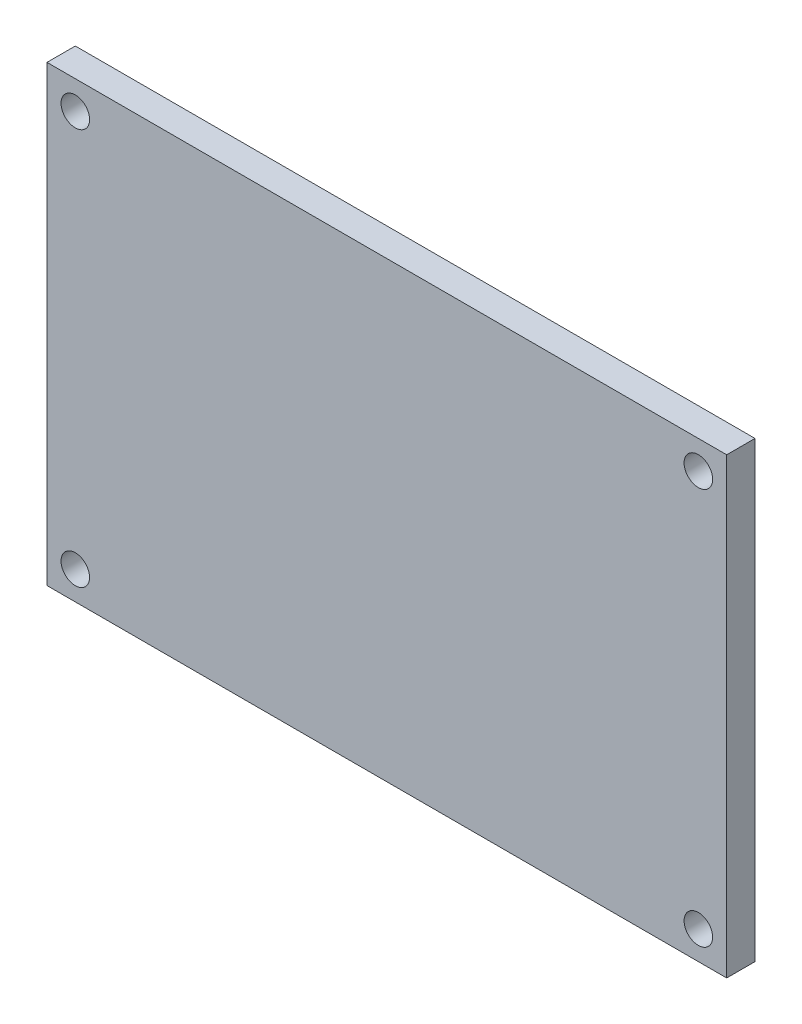
from build123d import *

# Parameters (mm, degrees)
SKETCH1_W           = 76.2
SKETCH1_H           = 50.8
BOSS_EXTRUDE1_DEPTH = 3.175
CUT_EXTRUDE1_REACH  = 47.9
SKETCH2_R           = 1.6
SKETCH2_R_2         = 1.599999975


with BuildPart() as part:
    # Sketch1 → Boss-Extrude1 (new body)
    with BuildSketch(Plane.XY):
        Rectangle(SKETCH1_W, SKETCH1_H)
    extrude(amount=BOSS_EXTRUDE1_DEPTH)

    # Sketch2 → Cut-Extrude1 (cut, up to next)
    with BuildSketch(Plane.XY.offset(3.175), mode=Mode.PRIVATE) as cut_extrude1_sk1:
        with Locations((-34.925, 22.225)):
            Circle(SKETCH2_R)
    cut_extrude1_tool1 = extrude(cut_extrude1_sk1.sketch, amount=-CUT_EXTRUDE1_REACH, mode=Mode.PRIVATE) & part.part
    # Sketch2 → Cut-Extrude1 (cut, up to next)
    with BuildSketch(Plane.XY.offset(3.175), mode=Mode.PRIVATE) as cut_extrude1_sk2:
        with Locations((-34.925, -22.225)):
            Circle(SKETCH2_R_2)
    cut_extrude1_tool2 = extrude(cut_extrude1_sk2.sketch, amount=-CUT_EXTRUDE1_REACH, mode=Mode.PRIVATE) & part.part
    # Sketch2 → Cut-Extrude1 (cut, up to next)
    with BuildSketch(Plane.XY.offset(3.175), mode=Mode.PRIVATE) as cut_extrude1_sk3:
        with Locations(Location((34.925, -22.225, 0), (0, 0, 180))):
            Circle(SKETCH2_R_2)
    cut_extrude1_tool3 = extrude(cut_extrude1_sk3.sketch, amount=-CUT_EXTRUDE1_REACH, mode=Mode.PRIVATE) & part.part
    # Sketch2 → Cut-Extrude1 (cut, up to next)
    with BuildSketch(Plane.XY.offset(3.175), mode=Mode.PRIVATE) as cut_extrude1_sk4:
        with Locations(Location((34.925, 22.225, 0), (0, 0, 180))):
            Circle(SKETCH2_R)
    cut_extrude1_tool4 = extrude(cut_extrude1_sk4.sketch, amount=-CUT_EXTRUDE1_REACH, mode=Mode.PRIVATE) & part.part
    add(cut_extrude1_tool1.solids().sort_by_distance((-34.925, 22.225, 3.175))[0], mode=Mode.SUBTRACT)
    add(cut_extrude1_tool2.solids().sort_by_distance((-34.925, -22.225, 3.175))[0], mode=Mode.SUBTRACT)
    add(cut_extrude1_tool3.solids().sort_by_distance((34.925, -22.225, 3.175))[0], mode=Mode.SUBTRACT)
    add(cut_extrude1_tool4.solids().sort_by_distance((34.925, 22.225, 3.175))[0], mode=Mode.SUBTRACT)


solid = part.part
